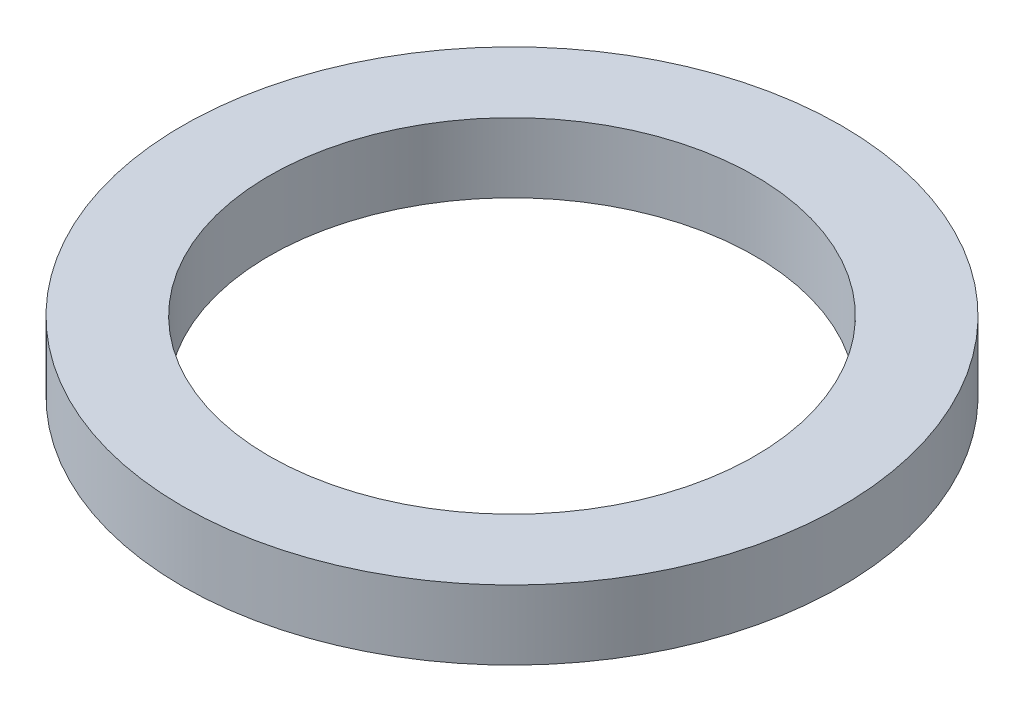
from build123d import *

# Parameters (mm, degrees)
SKETCH_1_R      = 47.5
SKETCH_1_R_2    = 35
EXTRUDE_1_DEPTH = 10


with BuildPart() as part:
    # 草圖1 → 填料-伸長1 (new body)
    with BuildSketch(Plane(origin=(0, 0, 0), x_dir=(1, 0, 0), z_dir=(0, 1, 0))):
        with Locations(Location((0, 0, 0), (0, 0, 270))):
            Circle(SKETCH_1_R)
        with Locations(Location((0, 0, 0), (0, 0, 270))):
            Circle(SKETCH_1_R_2, mode=Mode.SUBTRACT)
    extrude(amount=EXTRUDE_1_DEPTH)


solid = part.part
